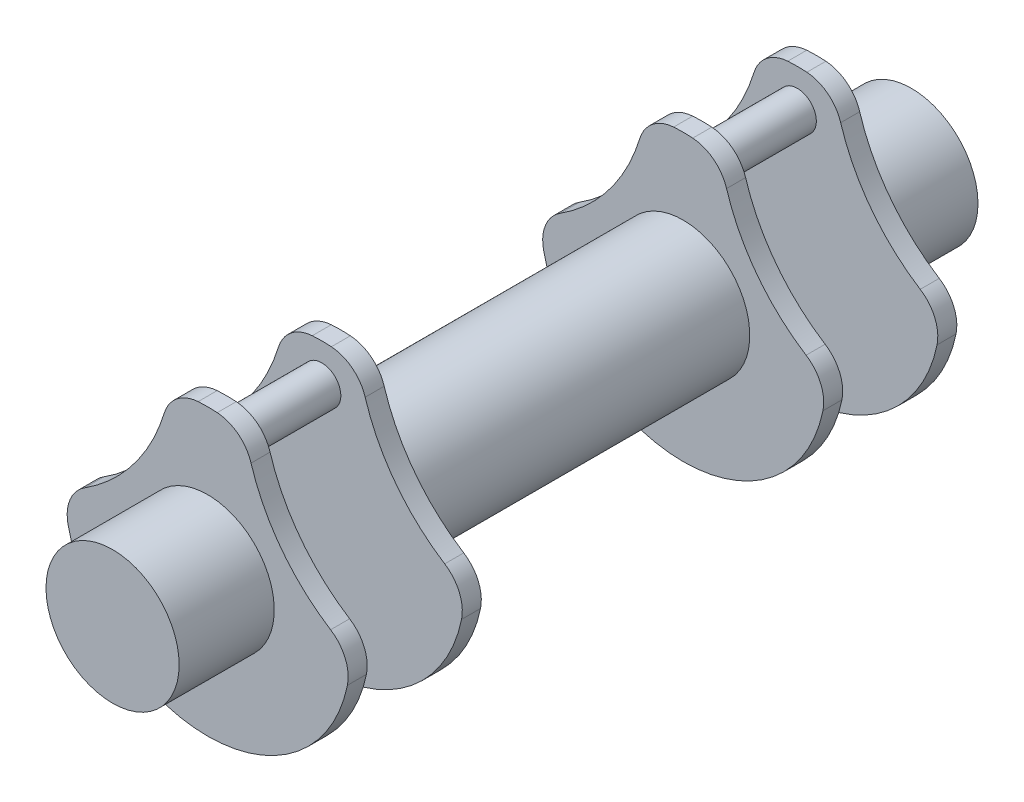
from build123d import *

# Parameters (mm, degrees)
BOSS_EXTRUDE1_DEPTH = 10
FILLET1_R           = 20
BOSS_EXTRUDE2_REACH = 123.17
SKETCH2_R           = 10
BOSS_EXTRUDE3_REACH = 273.26
SKETCH3_R           = 35
SKETCH4_R           = 35
BOSS_EXTRUDE4_DEPTH = 50


with BuildPart() as part:
    # Sketch1 → Boss-Extrude1 (new body)
    with BuildSketch(Plane.XY):
        with BuildLine():
            ThreePointArc((20, 72.284161474), (0, 75), (-20, 72.284161474))
            ThreePointArc((-20, 72.284161474), (-38.819684996, 29.537351354), (-75, 0))
            ThreePointArc((-75, 0), (0, -75), (75, 0))
            ThreePointArc((75, 0), (38.819684996, 29.537351354), (20, 72.284161474))
        make_face()
    extrude(amount=BOSS_EXTRUDE1_DEPTH)

    # Fillet1
    fillet1_edges = [part.edges().sort_by_distance(p)[0] for p in [
        (75, 0, 5),
        (-75, 0, 5),
        (-20, 72.284161474, 5),
        (20, 72.284161474, 5),
    ]]
    fillet(fillet1_edges, radius=FILLET1_R)


with BuildPart() as body_2:
    # Body-Move/Copy1: copy of part
    add(part.part.moved(Location((0, 0, 60))))

    # Sketch2 → Boss-Extrude2 (add, up to next)
    with BuildSketch(Plane.XY.offset(10), mode=Mode.PRIVATE) as boss_extrude2_sk1:
        with Locations(Location((0, 55, 0), (0, 0, 180))):
            Circle(SKETCH2_R)
    boss_extrude2_tool1 = extrude(boss_extrude2_sk1.sketch, amount=BOSS_EXTRUDE2_REACH, mode=Mode.PRIVATE) - body_2.part

    add(part.part)  # Boss-Extrude2 merges part
    add(boss_extrude2_tool1.solids().sort_by_distance((0, 55, 10))[0])


with BuildPart() as body_2_2:
    # Body-Move/Copy2: copy of body 2
    add(body_2.part.moved(Location((0, 0, -250))))


with BuildPart() as body_2_1:
    add(body_2.part)

    # Sketch3 → Boss-Extrude3 (add, up to next)
    with BuildSketch(Plane.XY.offset(-180), mode=Mode.PRIVATE) as boss_extrude3_sk1:
        with Locations(Location((0, 0, 0), (0, 0, 180))):
            Circle(SKETCH3_R)
    boss_extrude3_tool1 = extrude(boss_extrude3_sk1.sketch, amount=BOSS_EXTRUDE3_REACH, mode=Mode.PRIVATE) - body_2_1.part

    add(body_2_2.part)  # Boss-Extrude3 merges body 2 2
    add(boss_extrude3_tool1.solids().sort_by_distance((0, 0, -180))[0])

    # Sketch4 → Boss-Extrude4 (add)
    with BuildSketch(Plane.XY.offset(70)):
        with Locations(Location((0, 0, 0), (0, 0, 180))):
            Circle(SKETCH4_R)
    boss_extrude4 = extrude(amount=BOSS_EXTRUDE4_DEPTH)

    # Mirror1: Boss-Extrude4 across plane
    add(boss_extrude4.mirror(Plane.XY.offset(-90)))


solid = body_2_1.part
